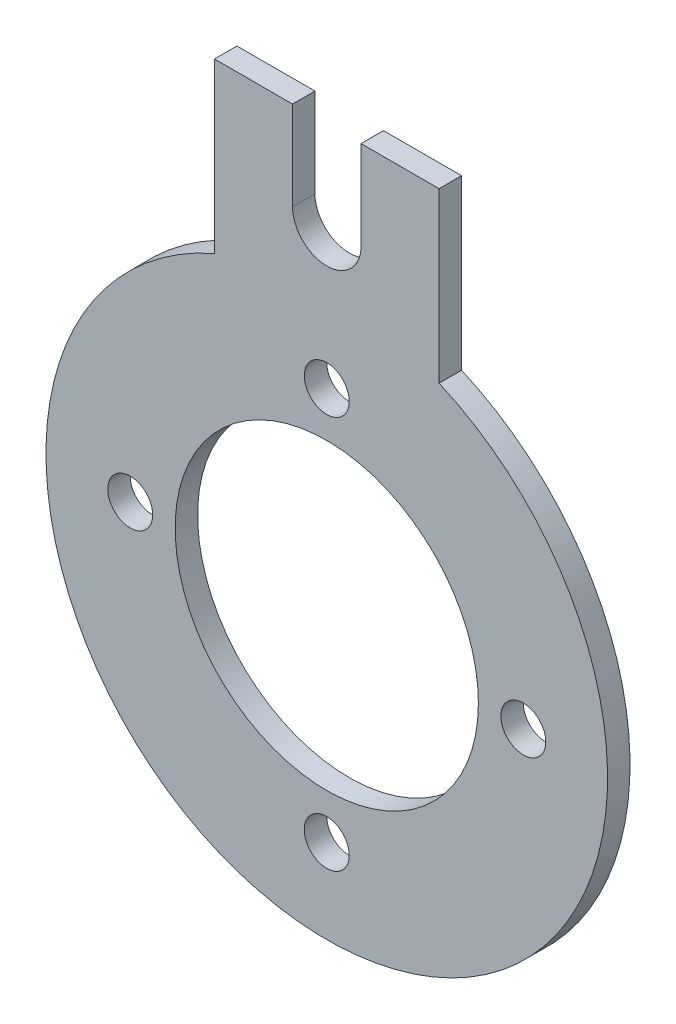
from build123d import *

# Parameters (mm, degrees)
SKETCH_1_R          = 25
SKETCH_1_R_2        = 2
EXTRUDE_1_DEPTH     = 2
EXTRUDE_START       = -2
EXTRUDE_2_DEPTH     = 2
SKETCH_3_R          = 13.5
CUT_EXTRUDE_1_DEPTH = 2


with BuildPart() as part:
    # 草图1 → 凸台-拉伸1 (new body)
    with BuildSketch(Plane.XY):
        Circle(SKETCH_1_R)
        with Locations((0, 17.5)):
            Circle(SKETCH_1_R_2, mode=Mode.SUBTRACT)
        with Locations((17.5, 0)):
            Circle(SKETCH_1_R_2, mode=Mode.SUBTRACT)
        with Locations((0, -17.5)):
            Circle(SKETCH_1_R_2, mode=Mode.SUBTRACT)
        with Locations((-17.5, 0)):
            Circle(SKETCH_1_R_2, mode=Mode.SUBTRACT)
    extrude(amount=EXTRUDE_1_DEPTH)

    # 草图2 → 凸台-拉伸2 (add)
    with BuildSketch(Plane.XY.offset(2).offset(EXTRUDE_START)):
        with BuildLine():
            Line((-10, 22.912878475), (-10, 37.912878475))
            Line((-10, 37.912878475), (-3.05, 37.912878475))
            Line((-3.05, 37.912878475), (-3.05, 30))
            ThreePointArc((-3.05, 30), (0, 26.95), (3.05, 30))
            Line((3.05, 30), (3.05, 37.912878475))
            Line((3.05, 37.912878475), (10, 37.912878475))
            Line((10, 37.912878475), (10, 22.912878475))
            ThreePointArc((10, 22.912878475), (0, 25), (-10, 22.912878475))
        make_face()
    extrude(amount=EXTRUDE_2_DEPTH)

    # 草图3 → 切除-拉伸1 (cut)
    with BuildSketch(Plane.XY.offset(2)):
        Circle(SKETCH_3_R)
    extrude(amount=-CUT_EXTRUDE_1_DEPTH, mode=Mode.SUBTRACT)


solid = part.part
